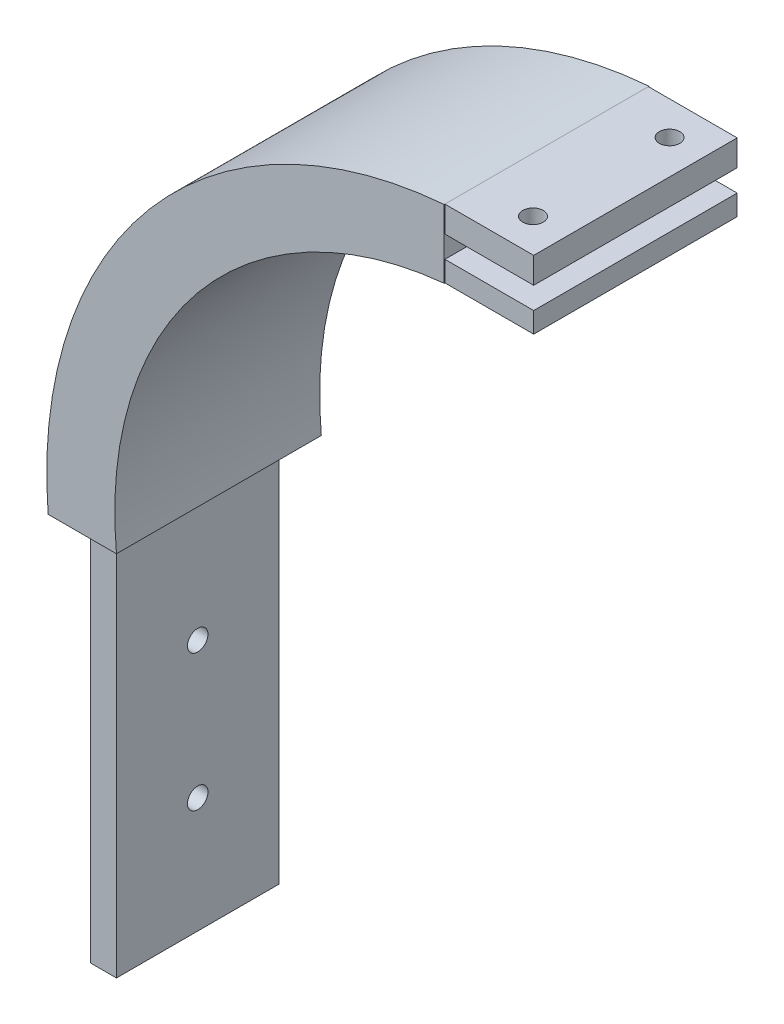
from build123d import *

# Parameters (mm, degrees)
BOSS_EXTRUDE1_DEPTH = 15
SKETCH2_W           = 3.8
SKETCH2_H           = 23.8
BOSS_EXTRUDE2_DEPTH = 56.9
SKETCH3_R           = 1.5
CUT_EXTRUDE1_DEPTH  = 3.8
SKETCH4_W           = 30
SKETCH4_H           = 3.8
SKETCH4_H_2         = 3
BOSS_EXTRUDE3_DEPTH = 13
CUT_EXTRUDE2_REACH  = 133.214
SKETCH5_R           = 1.5
SKETCH6_W           = 0.1
SKETCH6_H           = 10
CUT_EXTRUDE3_DEPTH  = 13


with BuildPart() as part:
    # Sketch1 → Boss-Extrude1 (new, symmetric)
    with BuildSketch(Plane.XY):
        with BuildLine():
            Line((-10, 0), (0, 0))
            ThreePointArc((0, 0), (11.925674657, 39.091125497), (48, 58.3))
            Line((48, 58.3), (48, 68.3))
            ThreePointArc((48, 68.3), (4.854606845, 46.162193309), (-10, 0))
        make_face()
    extrude(amount=BOSS_EXTRUDE1_DEPTH, both=True)

    # Sketch2 → Boss-Extrude2 (add)
    with BuildSketch(Plane.XZ):
        with Locations((-5, 0)):
            Rectangle(SKETCH2_W, SKETCH2_H)
    extrude(amount=BOSS_EXTRUDE2_DEPTH)

    # Sketch3 → Cut-Extrude1 (cut)
    with BuildSketch(Plane.ZY.offset(6.9)):
        with Locations((0, -20)):
            Circle(SKETCH3_R)
        with Locations((0, -40)):
            Circle(SKETCH3_R)
    extrude(amount=-CUT_EXTRUDE1_DEPTH, mode=Mode.SUBTRACT)

    # Sketch4 → Boss-Extrude3 (add)
    with BuildSketch(Plane(origin=(48, 0, 0), x_dir=(0, 0, -1), z_dir=(1, 0, 0))):
        with Locations((0, 66.4)):
            Rectangle(SKETCH4_W, SKETCH4_H)
        with Locations((0, 59.8)):
            Rectangle(SKETCH4_W, SKETCH4_H_2)
    extrude(amount=BOSS_EXTRUDE3_DEPTH)

    # Cut-Extrude2: up to this face of the body (flat: up to its plane)
    cut_extrude2_end = Plane(part.part.faces().sort_by_distance((54.5, 68.3, 0))[0])
    # Sketch5 → Cut-Extrude2 (cut, up to the picked face)
    with BuildSketch(Plane.XZ.offset(-58.3), mode=Mode.PRIVATE) as cut_extrude2_sk1:
        with Locations((56, 10)):
            Circle(SKETCH5_R)
    cut_extrude2_tool1 = split(extrude(cut_extrude2_sk1.sketch, amount=-CUT_EXTRUDE2_REACH, mode=Mode.PRIVATE), bisect_by=cut_extrude2_end, keep=Keep.BOTH, mode=Mode.PRIVATE)
    # Sketch5 → Cut-Extrude2 (cut, up to the picked face)
    with BuildSketch(Plane.XZ.offset(-58.3), mode=Mode.PRIVATE) as cut_extrude2_sk2:
        with Locations((56, -10)):
            Circle(SKETCH5_R)
    cut_extrude2_tool2 = split(extrude(cut_extrude2_sk2.sketch, amount=-CUT_EXTRUDE2_REACH, mode=Mode.PRIVATE), bisect_by=cut_extrude2_end, keep=Keep.BOTH, mode=Mode.PRIVATE)
    add(cut_extrude2_tool1.solids().sort_by(Axis((56, 58.3, 10), (0, 1, 0)))[0], mode=Mode.SUBTRACT)
    add(cut_extrude2_tool2.solids().sort_by(Axis((56, 58.3, -10), (0, 1, 0)))[0], mode=Mode.SUBTRACT)

    # Sketch6 → Cut-Extrude3 (cut)
    with BuildSketch(Plane(origin=(61, 0, 0), x_dir=(0, 0, -1), z_dir=(1, 0, 0))):
        with Locations((-14.95, 63.3)):
            Rectangle(SKETCH6_W, SKETCH6_H)
        with Locations((14.95, 63.3)):
            Rectangle(SKETCH6_W, SKETCH6_H)
    extrude(amount=-CUT_EXTRUDE3_DEPTH, mode=Mode.SUBTRACT)


solid = part.part
